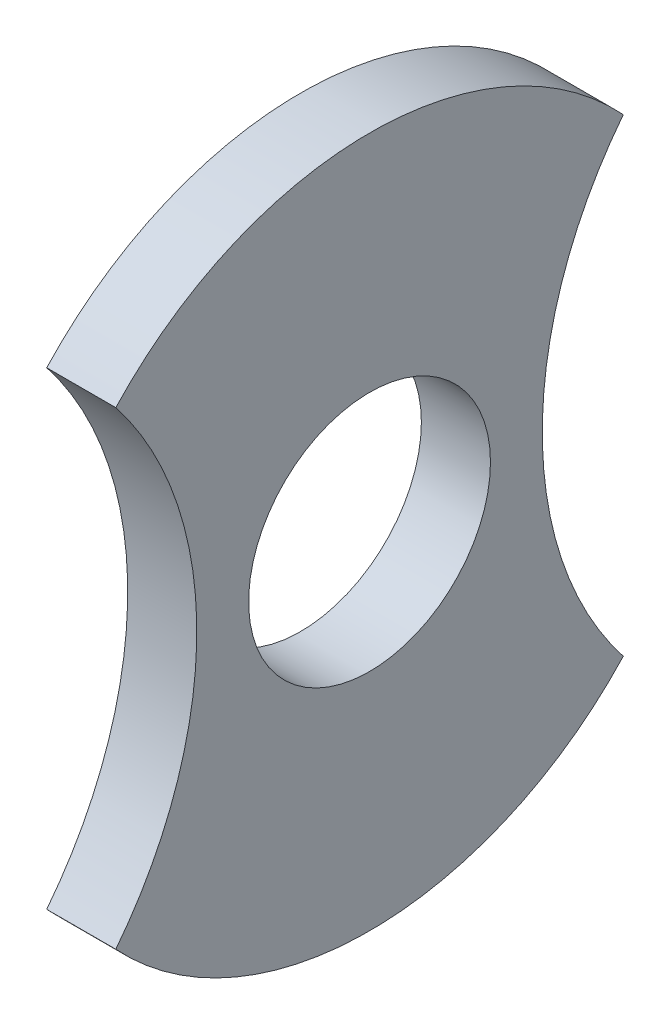
from build123d import *

# Parameters (mm, degrees)
BOSS_EXTRUDE1_DEPTH = 10
SKETCH3_R           = 17.5
CUT_EXTRUDE3_DEPTH  = 63.842489918


with BuildPart() as part:
    # Sketch1 → Boss-Extrude1 (new body)
    with BuildSketch(Plane(origin=(0, 0, 0), x_dir=(0, 0, -1), z_dir=(1, 0, 0))):
        with BuildLine():
            ThreePointArc((-36.722656494, 33.942179351), (-28.013204115, 17.954750168), (-25, 0))
            ThreePointArc((-25, 0), (-28.013204115, -17.954750168), (-36.722656494, -33.942179351))
            ThreePointArc((-36.722656494, -33.942179351), (0, -50.00625), (36.722656494, -33.942179351))
            ThreePointArc((36.722656494, -33.942179351), (28.013204115, -17.954750168), (25, 0))
            ThreePointArc((25, 0), (28.013204115, 17.954750168), (36.722656494, 33.942179351))
            ThreePointArc((36.722656494, 33.942179351), (0, 50.00625), (-36.722656494, 33.942179351))
        make_face()
    extrude(amount=BOSS_EXTRUDE1_DEPTH)

    # Sketch3 → Cut-Extrude3 (cut, through all)
    with BuildSketch(Plane(origin=(0, 0, 0), x_dir=(0, 0, -1), z_dir=(1, 0, 0))):
        Circle(SKETCH3_R)
    extrude(amount=CUT_EXTRUDE3_DEPTH, mode=Mode.SUBTRACT)


solid = part.part
